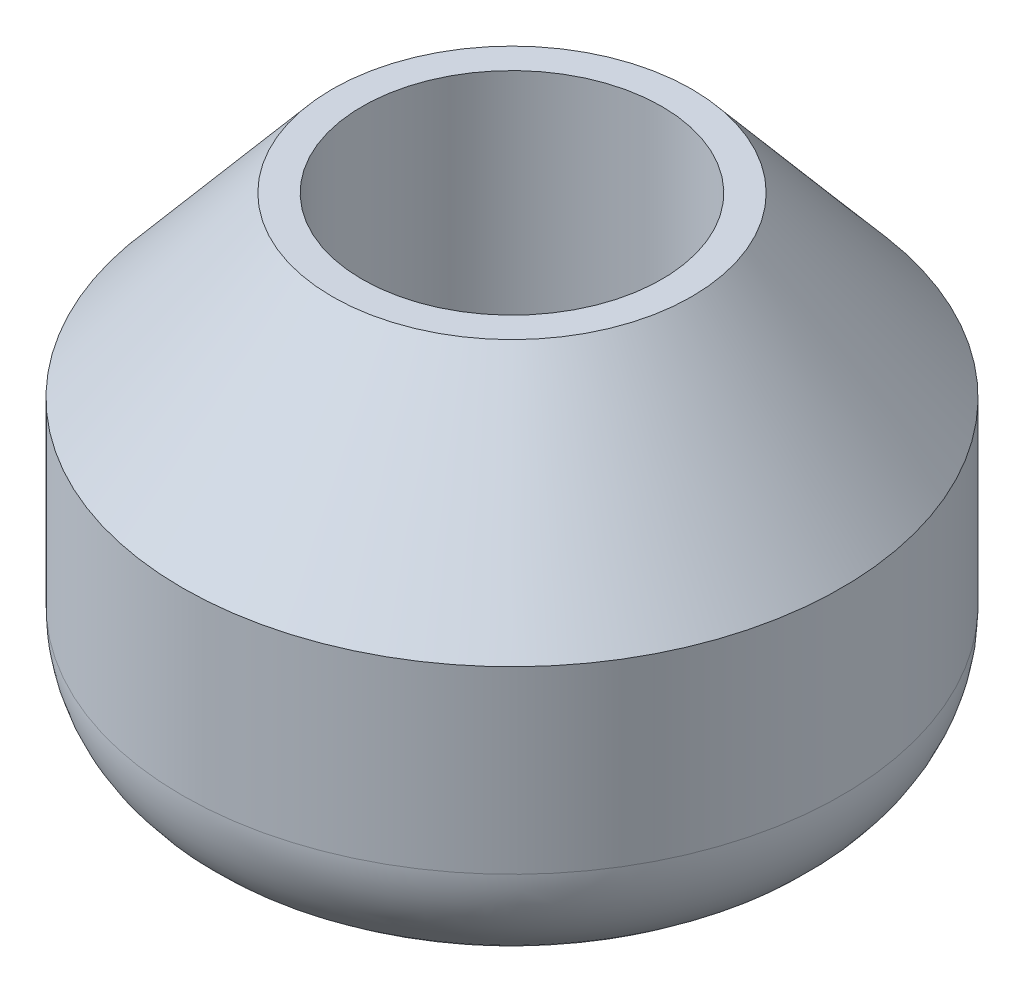
from build123d import *


with BuildPart() as part:
    # Schizzo1 → Rivoluzione1 (revolve)
    with BuildSketch(Plane.XY, mode=Mode.PRIVATE) as rivoluzione1_sk:
        with BuildLine():
            Line((5, 0), (5, 15.92))
            Line((5, 15.92), (6, 15.92))
            Line((6, 15.92), (11, 10))
            Line((11, 10), (11, 4))
            ThreePointArc((11, 4), (9.828427125, 1.171572875), (7, 0))
            Line((7, 0), (5, 0))
        make_face()
    revolve(rivoluzione1_sk.sketch.rotate(Axis((0, 0, 0), (0, 1, 0)), 90), axis=Axis((0, 0, 0), (0, 1, 0)))


solid = part.part
